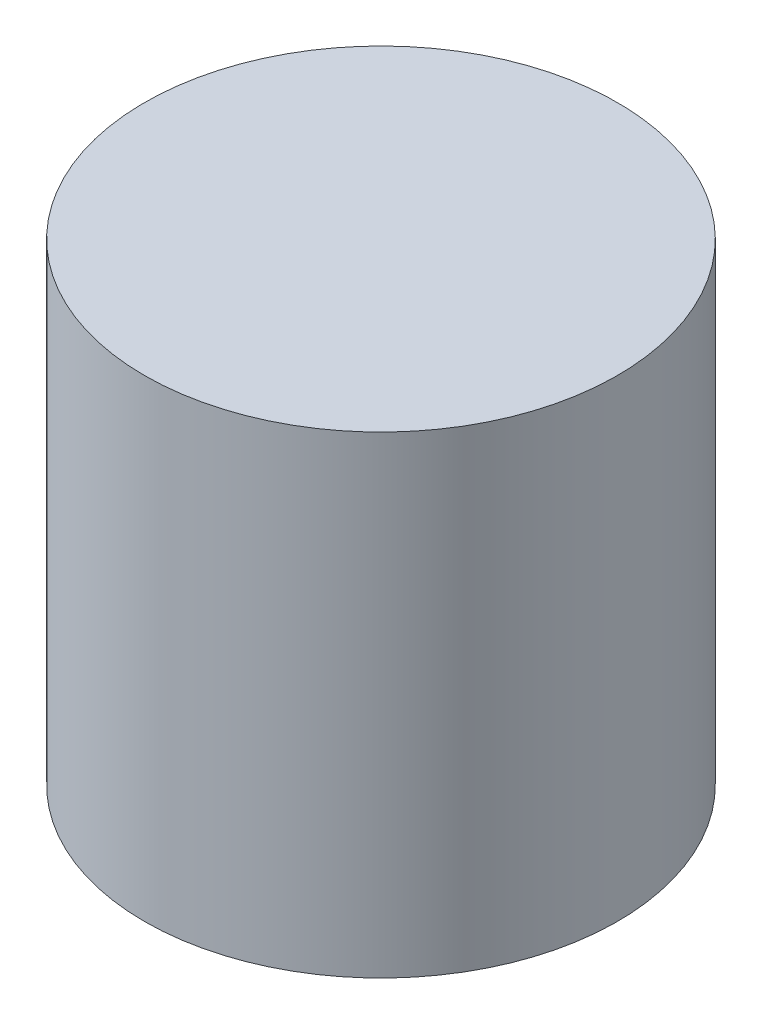
from build123d import *

# Parameters (mm, degrees)
SKETCH_1_R      = 1
EXTRUDE_1_DEPTH = 2


with BuildPart() as part:
    # 草图1 → 凸台-拉伸1 (new body)
    with BuildSketch(Plane(origin=(0, 0, 0), x_dir=(1, 0, 0), z_dir=(0, 1, 0))):
        with Locations(Location((0, 0, 0), (0, 0, 270))):
            Circle(SKETCH_1_R)
    extrude(amount=EXTRUDE_1_DEPTH)


solid = part.part
